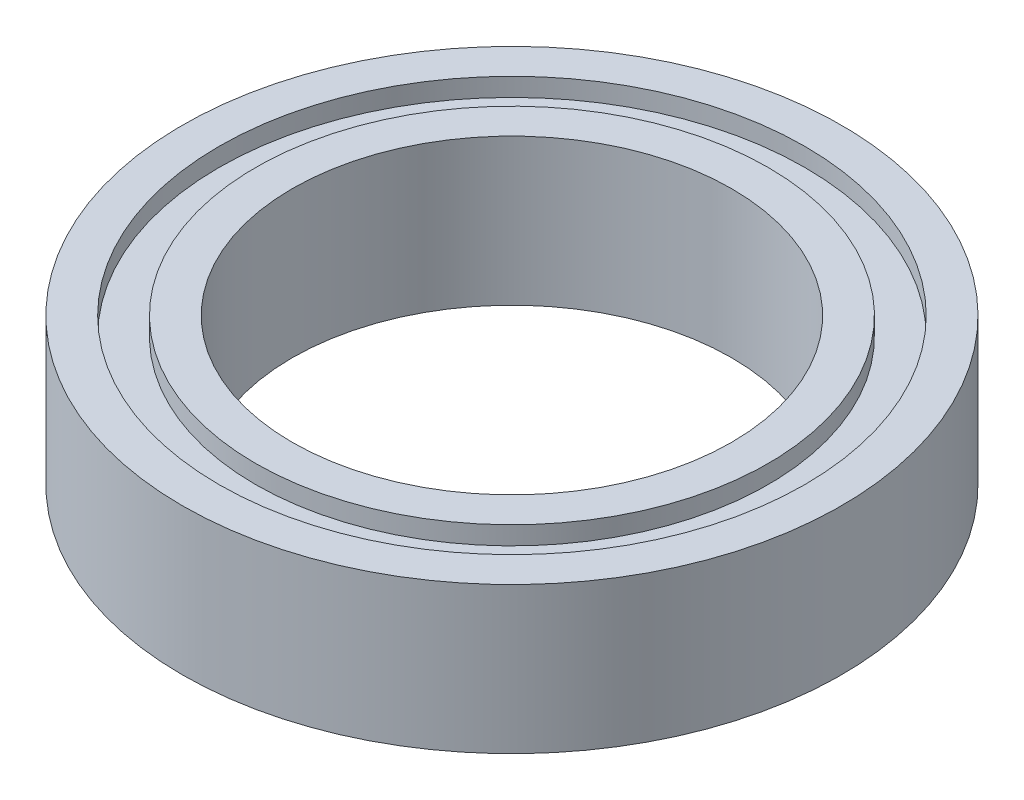
from build123d import *

# Parameters (mm, degrees)
SKETCH_1_R          = 9
SKETCH_1_R_2        = 6
EXTRUDE_1_DEPTH     = 2
SKETCH_2_R          = 8
SKETCH_2_R_2        = 7
CUT_EXTRUDE_1_DEPTH = 0.5


with BuildPart() as part:
    # 草图1 → 凸台-拉伸1 (new, symmetric)
    with BuildSketch(Plane(origin=(0, 0, 0), x_dir=(1, 0, 0), z_dir=(0, 1, 0))):
        with Locations(Location((0, 0, 0), (0, 0, 270))):
            Circle(SKETCH_1_R)
        with Locations(Location((0, 0, 0), (0, 0, 270))):
            Circle(SKETCH_1_R_2, mode=Mode.SUBTRACT)
    extrude(amount=EXTRUDE_1_DEPTH, both=True)

    # 草图2 → 切除-拉伸1 (cut)
    with BuildSketch(Plane(origin=(0, 2, 0), x_dir=(1, 0, 0), z_dir=(0, 1, 0))):
        with Locations(Location((0, 0, 0), (0, 0, 270))):
            Circle(SKETCH_2_R)
        with Locations(Location((0, 0, 0), (0, 0, 270))):
            Circle(SKETCH_2_R_2, mode=Mode.SUBTRACT)
    cut_extrude_1 = extrude(amount=-CUT_EXTRUDE_1_DEPTH, mode=Mode.SUBTRACT)

    # 镜向1: 切除-拉伸1 across plane
    add(cut_extrude_1.mirror(Plane.ZX), mode=Mode.SUBTRACT)


solid = part.part
